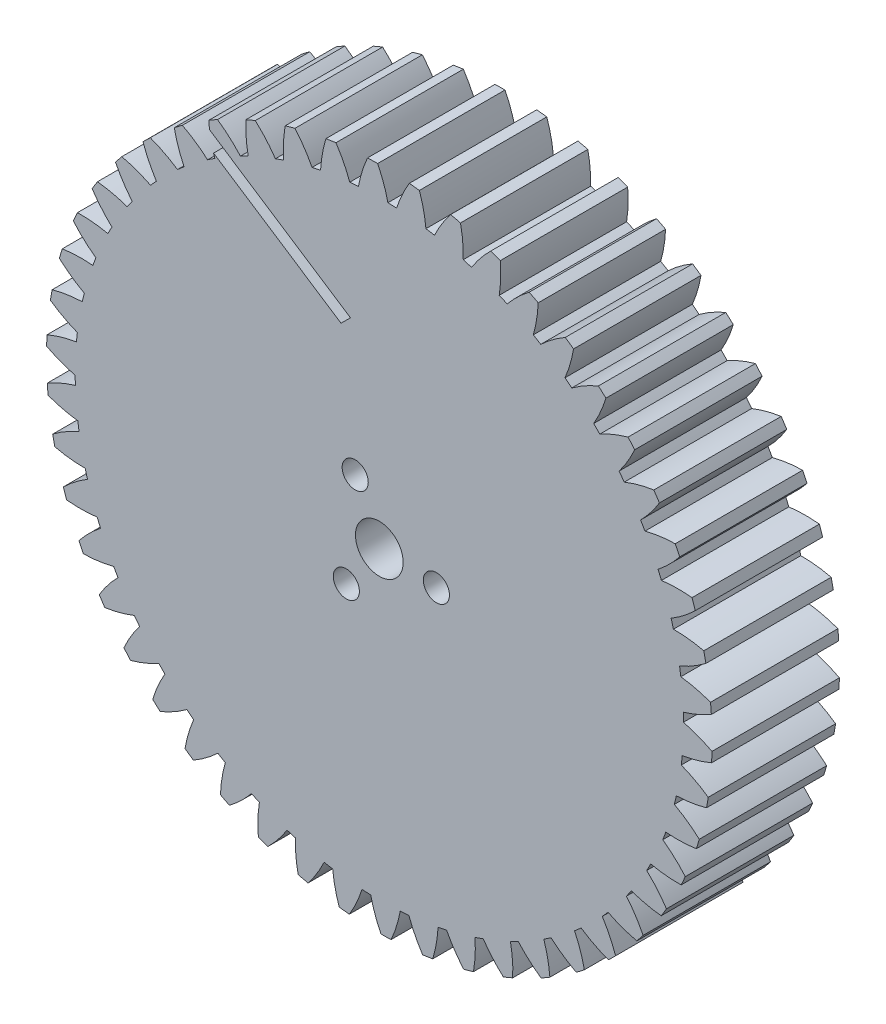
from build123d import *

# Parameters (mm, degrees)
SKETCH1_R                        = 52.37152557
BOSS_EXTRUDE1_DEPTH              = 10
SKETCH2_R                        = 130.599120945
CUT_EXTRUDE1_DEPTH               = 243.392566715
F_2_05_2_05_DIAMETER_HOLE1_D     = 2.05
F_2_05_2_05_DIAMETER_HOLE1_DEPTH = 75.15314796
SKETCH5_R                        = 1.873
CUT_EXTRUDE2_DEPTH               = 214.261484282
CUT_EXTRUDE3_DEPTH               = 211.837162193


with BuildPart() as part:
    # Sketch1 → Boss-Extrude1 (new body)
    with BuildSketch(Plane.XY):
        Circle(SKETCH1_R)
    extrude(amount=BOSS_EXTRUDE1_DEPTH)

    # Sketch2 → Cut-Extrude1 (cut, through all)
    with BuildSketch(Plane(origin=(-27.965211852, -165.986714684, 67.969433806), x_dir=(1, 0, 0), z_dir=(0, 0, 1))):
        with Locations((27.965211852, 165.986714684)):
            Circle(SKETCH2_R)
        with BuildLine():
            ThreePointArc((44.79599806, 182.921531235), (45.341039166, 183.992908037), (45.755295355, 185.121318364))
            ThreePointArc((45.755295355, 185.121318364), (45.461450094, 185.390368371), (45.163536348, 185.654906353))
            ThreePointArc((45.163536348, 185.654906353), (44.083853253, 185.126510223), (43.074384644, 184.473906833))
            ThreePointArc((43.074384644, 184.473906833), (42.809096525, 184.687582681), (42.540786966, 184.897452008))
            ThreePointArc((42.540786966, 184.897452008), (42.947251141, 186.028692447), (43.216813481, 187.200124989))
            ThreePointArc((43.216813481, 187.200124989), (42.89156437, 187.43022488), (42.562844362, 187.655338409))
            ThreePointArc((42.562844362, 187.655338409), (41.557900486, 186.995788666), (40.638184732, 186.221811284))
            ThreePointArc((40.638184732, 186.221811284), (40.348207804, 186.400552816), (40.055710345, 186.575139156))
            ThreePointArc((40.055710345, 186.575139156), (40.317187406, 187.748402895), (40.437804738, 188.944383462))
            ThreePointArc((40.437804738, 188.944383462), (40.08628115, 189.131904424), (39.731938992, 189.314043323))
            ThreePointArc((39.731938992, 189.314043323), (38.8175829, 188.533741462), (38.002124468, 187.650596173))
            ThreePointArc((38.002124468, 187.650596173), (37.69203184, 187.791584529), (37.37995934, 187.928134551))
            ThreePointArc((37.37995934, 187.928134551), (37.492325638, 189.124918521), (37.462095755, 190.326585784))
            ThreePointArc((37.462095755, 190.326585784), (37.089841427, 190.468570499), (36.715465305, 190.60486233))
            ThreePointArc((36.715465305, 190.60486233), (35.90611694, 189.716114177), (35.207776095, 188.73772871))
            ThreePointArc((35.207776095, 188.73772871), (34.882458114, 188.838740418), (34.555732143, 188.935100647))
            ThreePointArc((34.555732143, 188.935100647), (34.517215594, 190.13653085), (34.336615239, 191.324933799))
            ThreePointArc((34.336615239, 191.324933799), (33.949500844, 191.419143083), (33.560994894, 191.507438443))
            ThreePointArc((33.560994894, 191.507438443), (32.869418163, 190.524260086), (32.299208158, 189.466064165))
            ThreePointArc((32.299208158, 189.466064165), (31.963795283, 189.525506211), (31.627568504, 189.580156988))
            ThreePointArc((31.627568504, 189.580156988), (31.438776538, 190.767286152), (31.110653886, 191.923682962))
            ThreePointArc((31.110653886, 191.923682962), (30.71478445, 191.968631079), (30.318275642, 192.007537496))
            ThreePointArc((30.318275642, 192.007537496), (29.755377122, 190.945434247), (29.322290511, 189.824116252))
            ThreePointArc((29.322290511, 189.824116252), (28.982072402, 189.841051201), (28.641647313, 189.853130651))
            ThreePointArc((28.641647313, 189.853130651), (28.305557291, 191.007237038), (27.835087033, 192.113390641))
            ThreePointArc((27.835087033, 192.113390641), (27.436705653, 192.108368732), (27.038447168, 192.09727263))
            ThreePointArc((27.038447168, 192.09727263), (26.613104106, 190.97299449), (26.323970922, 189.806238278))
            ThreePointArc((26.323970922, 189.806238278), (25.984313023, 189.780399053), (25.645058331, 189.749716676))
            ThreePointArc((25.645058331, 189.749716676), (25.166970594, 190.852599341), (24.561572326, 191.891065033))
            ThreePointArc((24.561572326, 191.891065033), (24.166961714, 191.836152297), (23.773234327, 191.775228667))
            ThreePointArc((23.773234327, 191.775228667), (23.492154637, 190.606506175), (23.351534683, 189.412712187))
            ThreePointArc((23.351534683, 189.412712187), (23.017793601, 189.344506289), (22.685059556, 189.271545964))
            ThreePointArc((22.685059556, 189.271545964), (22.072513833, 190.305811788), (21.341735048, 191.260212346))
            ThreePointArc((21.341735048, 191.260212346), (20.957118449, 191.156274789), (20.574131476, 191.046484433))
            ThreePointArc((20.574131476, 191.046484433), (20.441747952, 189.85174904), (20.451858889, 188.649744121))
            ThreePointArc((20.451858889, 188.649744121), (20.129297921, 188.540247199), (19.808331936, 188.426159554))
            ThreePointArc((19.808331936, 188.426159554), (19.070988439, 189.375497546), (18.226353956, 190.230781502))
            ThreePointArc((18.226353956, 190.230781502), (17.857797003, 190.079458282), (17.491590377, 189.922532661))
            ThreePointArc((17.491590377, 189.922532661), (17.509990787, 188.720626058), (17.670673159, 187.529366543))
            ThreePointArc((17.670673159, 187.529366543), (17.364379285, 187.380305427), (17.060243186, 187.226889693))
            ThreePointArc((17.060243186, 187.226889693), (16.209730262, 188.076328227), (15.26456047, 188.819007243))
            ThreePointArc((15.26456047, 188.819007243), (14.917875528, 188.622684817), (14.574224546, 188.42109874))
            ThreePointArc((14.574224546, 188.42109874), (14.743118704, 187.230975713), (15.051838455, 186.069248476))
            ThreePointArc((15.051838455, 186.069248476), (14.76664211, 185.88297395), (14.484132306, 185.692649584))
            ThreePointArc((14.484132306, 185.692649584), (13.533863052, 186.428792507), (12.503063844, 187.04715409))
            ThreePointArc((12.503063844, 187.04715409), (12.18371834, 186.808928581), (11.868042584, 186.565861181))
            ThreePointArc((11.868042584, 186.565861181), (12.184766928, 185.40629068), (12.636655363, 184.292416855))
            ThreePointArc((12.636655363, 184.292416855), (12.377054265, 184.071866579), (12.120626103, 183.84763511))
            ThreePointArc((12.120626103, 183.84763511), (11.085586834, 184.458873007), (9.985414528, 184.943165227))
            ThreePointArc((9.985414528, 184.943165227), (9.698444733, 184.666793592), (9.415722597, 184.386078189))
            ThreePointArc((9.415722597, 184.386078189), (9.875282196, 183.275347334), (10.463212763, 182.226893375))
            ThreePointArc((10.463212763, 182.226893375), (10.233300977, 181.975545559), (10.006998483, 181.720943251))
            ThreePointArc((10.006998483, 181.720943251), (8.903512385, 182.197636537), (7.751317357, 182.540221815))
            ThreePointArc((7.751317357, 182.540221815), (7.501248955, 182.230062601), (7.255939136, 181.916126243))
            ThreePointArc((7.255939136, 181.916126243), (7.85108646, 180.871751923), (8.565787145, 179.905252576))
            ThreePointArc((8.565787145, 179.905252576), (8.369190517, 179.627071125), (8.176582615, 179.346113209))
            ThreePointArc((8.176582615, 179.346113209), (7.022052324, 179.680744145), (5.836005377, 179.876219707))
            ThreePointArc((5.836005377, 179.876219707), (5.626782096, 179.537164309), (5.422753278, 179.19495796))
            ThreePointArc((5.422753278, 179.19495796), (6.144102498, 178.233410583), (6.974302043, 177.364108119))
            ThreePointArc((6.974302043, 177.364108119), (6.814121018, 177.063480121), (6.658245252, 176.760597471))
            ThreePointArc((6.658245252, 176.760597471), (5.4708784, 176.947888727), (4.269684202, 176.993171808))
            ThreePointArc((4.269684202, 176.993171808), (4.104605619, 176.630567333), (3.945075458, 176.265487791))
            ThreePointArc((3.945075458, 176.265487791), (4.781250465, 175.401931532), (5.713856127, 174.643535372))
            ThreePointArc((5.713856127, 174.643535372), (5.592616857, 174.325201909), (5.47593148, 174.005171166))
            ThreePointArc((5.47593148, 174.005171166), (4.274453551, 174.042169048), (3.077055654, 173.936545504))
            ThreePointArc((3.077055654, 173.936545504), (2.958725156, 173.556110441), (2.846209537, 173.17391523))
            ThreePointArc((2.846209537, 173.17391523), (3.784023353, 172.421968888), (4.804327384, 171.786439391))
            ThreePointArc((4.804327384, 171.786439391), (4.723941884, 171.455420773), (4.648287094, 171.123289012))
            ThreePointArc((4.648287094, 171.123289012), (3.451646113, 171.009410041), (2.276928197, 170.75454562))
            ThreePointArc((2.276928197, 170.75454562), (2.207211927, 170.362279657), (2.143485288, 169.968996223))
            ThreePointArc((2.143485288, 169.968996223), (3.168148029, 169.34051844), (4.260059625, 168.837878287))
            ThreePointArc((4.260059625, 168.837878287), (4.221795622, 168.499394875), (4.18836454, 168.160400013))
            ThreePointArc((4.18836454, 168.160400013), (3.015432251, 167.897440127), (1.881920318, 167.497354194))
            ThreePointArc((1.881920318, 167.497354194), (1.861917743, 167.0994436), (1.847985092, 166.701274257))
            ThreePointArc((1.847985092, 166.701274257), (2.943337215, 166.206176504), (4.089636277, 165.84435263))
            ThreePointArc((4.089636277, 165.84435263), (4.094097218, 165.503742509), (4.103417072, 165.163230697))
            ThreePointArc((4.103417072, 165.163230697), (2.972691317, 164.755336932), (1.898261528, 164.21633908))
            ThreePointArc((1.898261528, 164.21633908), (1.9282881, 163.819059143), (1.964369164, 163.42228326))
            ThreePointArc((1.964369164, 163.42228326), (3.11313631, 163.068373524), (4.295745018, 162.853072107))
            ThreePointArc((4.295745018, 162.853072107), (4.342860551, 162.515706903), (4.394784362, 162.179048216))
            ThreePointArc((4.394784362, 162.179048216), (3.324097362, 161.6326533), (2.325694116, 160.963243847))
            ThreePointArc((2.325694116, 160.963243847), (2.405276299, 160.572859908), (2.490802058, 160.183734879))
            ThreePointArc((2.490802058, 160.183734879), (3.674867483, 159.976594527), (4.875135391, 159.911210999))
            ThreePointArc((4.875135391, 159.911210999), (4.964162476, 159.582411163), (5.057871374, 159.254914909))
            ThreePointArc((5.057871374, 159.254914909), (4.064108502, 158.578635817), (3.157477215, 157.78937175))
            ThreePointArc((3.157477215, 157.78937175), (3.285359951, 157.412040397), (3.418981611, 157.036702955))
            ThreePointArc((3.418981611, 157.036702955), (4.619671897, 156.979598716), (5.818670063, 157.065164215))
            ThreePointArc((5.818670063, 157.065164215), (5.948204689, 156.750115116), (6.082220829, 156.436946107))
            ThreePointArc((6.082220829, 156.436946107), (5.18105432, 155.641448163), (4.380493109, 154.744776648))
            ThreePointArc((4.380493109, 154.744776648), (4.55465961, 154.386448623), (4.734269879, 154.030818063))
            ThreePointArc((4.734269879, 154.030818063), (5.932649422, 154.124650503), (7.111468929, 154.35981561))
            ThreePointArc((7.111468929, 154.35981561), (7.279468258, 154.063485761), (7.451678125, 153.769582859))
            ThreePointArc((7.451678125, 153.769582859), (6.657319912, 152.867411542), (5.975454106, 151.877473625))
            ThreePointArc((5.975454106, 151.877473625), (6.193157662, 151.543799973), (6.415923979, 151.213484802))
            ThreePointArc((6.415923979, 151.213484802), (7.593093618, 151.456774129), (8.733143778, 151.83783015))
            ThreePointArc((8.733143778, 151.83783015), (8.93695836, 151.564892849), (9.144646102, 151.294891079))
            ThreePointArc((9.144646102, 151.294891079), (8.46962369, 150.300274168), (7.917206719, 149.232681761))
            ThreePointArc((7.917206719, 149.232681761), (8.175014015, 148.928924717), (8.437423221, 148.629134202))
            ThreePointArc((8.437423221, 148.629134202), (9.574818289, 149.018043598), (10.658119829, 149.53898105))
            ThreePointArc((10.658119829, 149.53898105), (10.894535387, 149.293740683), (11.134425644, 149.051898134))
            ThreePointArc((11.134425644, 149.051898134), (10.589384538, 147.980521332), (10.175128349, 146.852111005))
            ThreePointArc((10.175128349, 146.852111005), (10.46897361, 146.583060998), (10.766887356, 146.318523015))
            ThreePointArc((10.766887356, 146.318523015), (11.846570451, 146.846919146), (12.85603906, 147.499522536))
            ThreePointArc((12.85603906, 147.499522536), (13.121327179, 147.285846688), (13.389636738, 147.075977361))
            ThreePointArc((13.389636738, 147.075977361), (12.983172564, 145.944736922), (12.713610224, 144.77330438))
            ThreePointArc((12.713610224, 144.77330438), (13.038859334, 144.543204489), (13.367579342, 144.31809096))
            ThreePointArc((13.367579342, 144.31809096), (14.372523218, 144.977640703), (15.292238972, 145.751618085))
            ThreePointArc((15.292238972, 145.751618085), (15.5822159, 145.572876553), (15.87471336, 145.398290213))
            ThreePointArc((15.87471336, 145.398290213), (15.613236298, 144.225026474), (15.492618966, 143.029045907))
            ThreePointArc((15.492618966, 143.029045907), (15.844142554, 142.841524945), (16.198484712, 142.659386046))
            ThreePointArc((16.198484712, 142.659386046), (17.112840804, 143.439687907), (17.928299237, 144.322833196))
            ThreePointArc((17.928299237, 144.322833196), (18.238391864, 144.18184484), (18.550464364, 144.045294818))
            ThreePointArc((18.550464364, 144.045294818), (18.438098066, 142.848510848), (18.46832795, 141.646843585))
            ThreePointArc((18.46832795, 141.646843585), (18.840582277, 141.50485887), (19.214958399, 141.368567039))
            ThreePointArc((19.214958399, 141.368567039), (20.024306764, 142.257315192), (20.722647609, 143.235700659))
            ThreePointArc((20.722647609, 143.235700659), (21.04796559, 143.13468895), (21.374691561, 143.038328722))
            ThreePointArc((21.374691561, 143.038328722), (21.41320811, 141.836898519), (21.593808465, 140.64849557))
            ThreePointArc((21.593808465, 140.64849557), (21.98092286, 140.554286286), (22.36942881, 140.465990926))
            ThreePointArc((22.36942881, 140.465990926), (23.061005542, 141.449169283), (23.631215546, 142.507365204))
            ThreePointArc((23.631215546, 142.507365204), (23.966628421, 142.447923158), (24.3028552, 142.39327238))
            ThreePointArc((24.3028552, 142.39327238), (24.491647166, 141.206143217), (24.819769818, 140.049746407))
            ThreePointArc((24.819769818, 140.049746407), (25.215639255, 140.00479829), (25.612148062, 139.965891873))
            ThreePointArc((25.612148062, 139.965891873), (26.175046582, 141.027995122), (26.608133194, 142.149313116))
            ThreePointArc((26.608133194, 142.149313116), (26.948351302, 142.132378168), (27.288776391, 142.120298718))
            ThreePointArc((27.288776391, 142.120298718), (27.624866413, 140.966192331), (28.095336671, 139.860038728))
            ThreePointArc((28.095336671, 139.860038728), (28.493718052, 139.865060637), (28.891976536, 139.876156739))
            ThreePointArc((28.891976536, 139.876156739), (29.317319598, 141.000434879), (29.606452782, 142.167191091))
            ThreePointArc((29.606452782, 142.167191091), (29.946110682, 142.193030316), (30.285365373, 142.223712693))
            ThreePointArc((30.285365373, 142.223712693), (30.76345311, 141.120830028), (31.368851378, 140.082364336))
            ThreePointArc((31.368851378, 140.082364336), (31.76346199, 140.137277072), (32.157189377, 140.198200702))
            ThreePointArc((32.157189377, 140.198200702), (32.438269068, 141.366923194), (32.578889021, 142.560717182))
            ThreePointArc((32.578889021, 142.560717182), (32.912630103, 142.62892308), (33.245364148, 142.701883405))
            ThreePointArc((33.245364148, 142.701883405), (33.857909872, 141.667617581), (34.588688656, 140.713217023))
            ThreePointArc((34.588688656, 140.713217023), (34.973305255, 140.81715458), (35.356292229, 140.926944936))
            ThreePointArc((35.356292229, 140.926944936), (35.488675753, 142.121680329), (35.478564815, 143.323685248))
            ThreePointArc((35.478564815, 143.323685248), (35.801125783, 143.43318217), (36.122091768, 143.547269815))
            ThreePointArc((36.122091768, 143.547269815), (36.859435265, 142.597931823), (37.704069749, 141.742647867))
            ThreePointArc((37.704069749, 141.742647867), (38.072626701, 141.893971087), (38.438833327, 142.050896708))
            ThreePointArc((38.438833327, 142.050896708), (38.420432918, 143.252803311), (38.259750545, 144.444062826))
            ThreePointArc((38.259750545, 144.444062826), (38.56604442, 144.593123942), (38.870180518, 144.746539676))
            ThreePointArc((38.870180518, 144.746539676), (39.720693442, 143.897101142), (40.665863234, 143.154422126))
            ThreePointArc((40.665863234, 143.154422126), (41.012548176, 143.350744552), (41.356199159, 143.552330629))
            ThreePointArc((41.356199159, 143.552330629), (41.187305001, 144.742453656), (40.878585249, 145.904180893))
            ThreePointArc((40.878585249, 145.904180893), (41.163781594, 146.090455419), (41.446291398, 146.280779785))
            ThreePointArc((41.446291398, 146.280779785), (42.396560652, 145.544636862), (43.427359861, 144.926275279))
            ThreePointArc((43.427359861, 144.926275279), (43.746705364, 145.164500788), (44.062381121, 145.407568188))
            ThreePointArc((44.062381121, 145.407568188), (43.745656776, 146.567138688), (43.293768341, 147.681012514))
            ThreePointArc((43.293768341, 147.681012514), (43.553369439, 147.90156279), (43.809797601, 148.125794259))
            ThreePointArc((43.809797601, 148.125794259), (44.84483687, 147.514556361), (45.945009176, 147.030264142))
            ThreePointArc((45.945009176, 147.030264142), (46.231978972, 147.306635777), (46.514701107, 147.58735118))
            ThreePointArc((46.514701107, 147.58735118), (46.055141509, 148.698082035), (45.467210941, 149.746535994))
            ThreePointArc((45.467210941, 149.746535994), (45.697122727, 149.99788381), (45.923425221, 150.252486118))
            ThreePointArc((45.923425221, 150.252486118), (47.026911319, 149.775792832), (48.179106348, 149.433207554))
            ThreePointArc((48.179106348, 149.433207554), (48.42917475, 149.743366768), (48.674484568, 150.057303126))
            ThreePointArc((48.674484568, 150.057303126), (48.079337244, 151.101677446), (47.364636559, 152.068176793))
            ThreePointArc((47.364636559, 152.068176793), (47.561233188, 152.346358244), (47.753841089, 152.62731616))
            ThreePointArc((47.753841089, 152.62731616), (48.90837138, 152.292685224), (50.094418327, 152.097209662))
            ThreePointArc((50.094418327, 152.097209662), (50.303641608, 152.43626506), (50.507670426, 152.778471409))
            ThreePointArc((50.507670426, 152.778471409), (49.786321206, 153.740018786), (48.956121662, 154.60932125))
            ThreePointArc((48.956121662, 154.60932125), (49.116302686, 154.909949248), (49.272178452, 155.212831898))
            ThreePointArc((49.272178452, 155.212831898), (50.459545305, 155.025540642), (51.660739502, 154.980257561))
            ThreePointArc((51.660739502, 154.980257561), (51.825818085, 155.342862036), (51.985348247, 155.707941577))
            ThreePointArc((51.985348247, 155.707941577), (51.149173239, 156.571497837), (50.216567577, 157.329893997))
            ThreePointArc((50.216567577, 157.329893997), (50.337806847, 157.64822746), (50.454492224, 157.968258203))
            ThreePointArc((50.454492224, 157.968258203), (51.655970153, 157.931260321), (52.85336805, 158.036883865))
            ThreePointArc((52.85336805, 158.036883865), (52.971698548, 158.417318928), (53.084214167, 158.799514139))
            ThreePointArc((53.084214167, 158.799514139), (52.146400351, 159.551460481), (51.12609632, 160.186989978))
            ThreePointArc((51.12609632, 160.186989978), (51.20648182, 160.518008596), (51.28213661, 160.850140357))
            ThreePointArc((51.28213661, 160.850140357), (52.478777591, 160.964019328), (53.653495508, 161.218883749))
            ThreePointArc((53.653495508, 161.218883749), (53.723211778, 161.611149712), (53.786938416, 162.004433146))
            ThreePointArc((53.786938416, 162.004433146), (52.762275675, 162.632910929), (51.670364079, 163.135551082))
            ThreePointArc((51.670364079, 163.135551082), (51.708628082, 163.474034494), (51.742059164, 163.813029356))
            ThreePointArc((51.742059164, 163.813029356), (52.914991453, 164.075989242), (54.048503387, 164.476075175))
            ThreePointArc((54.048503387, 164.476075175), (54.068505962, 164.873985769), (54.082438612, 165.272155111))
            ThreePointArc((54.082438612, 165.272155111), (52.98708649, 165.767252865), (51.840787427, 166.129076739))
            ThreePointArc((51.840787427, 166.129076739), (51.836326486, 166.46968686), (51.827006632, 166.810198672))
            ThreePointArc((51.827006632, 166.810198672), (52.957732387, 167.218092437), (54.032162177, 167.757090289))
            ThreePointArc((54.032162177, 167.757090289), (54.002135604, 168.154370226), (53.96605454, 168.551146109))
            ThreePointArc((53.96605454, 168.551146109), (52.817287394, 168.905055845), (51.634678686, 169.120357262))
            ThreePointArc((51.634678686, 169.120357262), (51.587563153, 169.457722466), (51.535639342, 169.794381153))
            ThreePointArc((51.535639342, 169.794381153), (52.606326343, 170.340776069), (53.604729588, 171.010185522))
            ThreePointArc((53.604729588, 171.010185522), (53.525147405, 171.400569461), (53.439621647, 171.78969449))
            ThreePointArc((53.439621647, 171.78969449), (52.255556221, 171.996834842), (51.055288313, 172.062218369))
            ThreePointArc((51.055288313, 172.062218369), (50.966261228, 172.391018206), (50.87255233, 172.71851446))
            ThreePointArc((50.87255233, 172.71851446), (51.866315202, 173.394793552), (52.772946489, 174.184057619))
            ThreePointArc((52.772946489, 174.184057619), (52.645063753, 174.561388971), (52.511442093, 174.936726414))
            ThreePointArc((52.511442093, 174.936726414), (51.310751807, 174.993830653), (50.111753641, 174.908265154))
            ThreePointArc((50.111753641, 174.908265154), (49.982219015, 175.223314253), (49.848202875, 175.536483262))
            ThreePointArc((49.848202875, 175.536483262), (50.749369385, 176.331981206), (51.549930595, 177.228652721))
            ThreePointArc((51.549930595, 177.228652721), (51.375764095, 177.586980746), (51.196153826, 177.942611306))
            ThreePointArc((51.196153826, 177.942611306), (49.997774282, 177.848778865), (48.818954776, 177.613613759))
            ThreePointArc((48.818954776, 177.613613759), (48.650955446, 177.909943608), (48.478745579, 178.20384651))
            ThreePointArc((48.478745579, 178.20384651), (49.273103792, 179.106017827), (49.954969598, 180.095955744))
            ThreePointArc((49.954969598, 180.095955744), (49.737266042, 180.429629396), (49.514499726, 180.759944567))
            ThreePointArc((49.514499726, 180.759944567), (48.337330086, 180.516655239), (47.197279927, 180.135599219))
            ThreePointArc((47.197279927, 180.135599219), (46.993465344, 180.40853652), (46.785777602, 180.67853829))
            ThreePointArc((46.785777602, 180.67853829), (47.460800015, 181.673155201), (48.013216985, 182.740747608))
            ThreePointArc((48.013216985, 182.740747608), (47.755409689, 183.044504652), (47.493000483, 183.344295167))
            ThreePointArc((47.493000483, 183.344295167), (46.355605416, 182.955385771), (45.272303875, 182.434448319))
            ThreePointArc((45.272303875, 182.434448319), (45.035888317, 182.679688686), (44.79599806, 182.921531235))
        make_face(mode=Mode.SUBTRACT)
    extrude(amount=-CUT_EXTRUDE1_DEPTH, mode=Mode.SUBTRACT)

    # Ø2.05 (2.05) Diameter Hole1
    with Locations(Plane(origin=(-27.965211852, -165.986714684, 75.15314796), x_dir=(1, 0, 0), z_dir=(0, 0, 1))):
        with Locations((32.447172363, 165.584185204), (25.375630841, 162.306487764), (26.072832352, 170.069471085)):
            Hole(F_2_05_2_05_DIAMETER_HOLE1_D / 2, depth=F_2_05_2_05_DIAMETER_HOLE1_DEPTH)

    # Sketch5 → Cut-Extrude2 (cut, through all)
    with BuildSketch(Plane(origin=(-27.965211852, -165.986714684, 75.15314796), x_dir=(1, 0, 0), z_dir=(0, 0, 1))):
        with Locations((27.965211852, 165.986714684)):
            Circle(SKETCH5_R)
    extrude(amount=-CUT_EXTRUDE2_DEPTH, mode=Mode.SUBTRACT)

    # Sketch6 → Cut-Extrude3 (cut, through all)
    with BuildSketch(Plane(origin=(-27.965211852, -165.986714684, 67.969433806), x_dir=(1, 0, 0), z_dir=(0, 0, 1))):
        Polygon((24.961925832, 179.821739867), (25.698350552, 180.558164587), (13.037660052, 188.857523316), (12.478671639, 188.004785228), align=None)
    extrude(amount=-CUT_EXTRUDE3_DEPTH, mode=Mode.SUBTRACT)


solid = part.part
